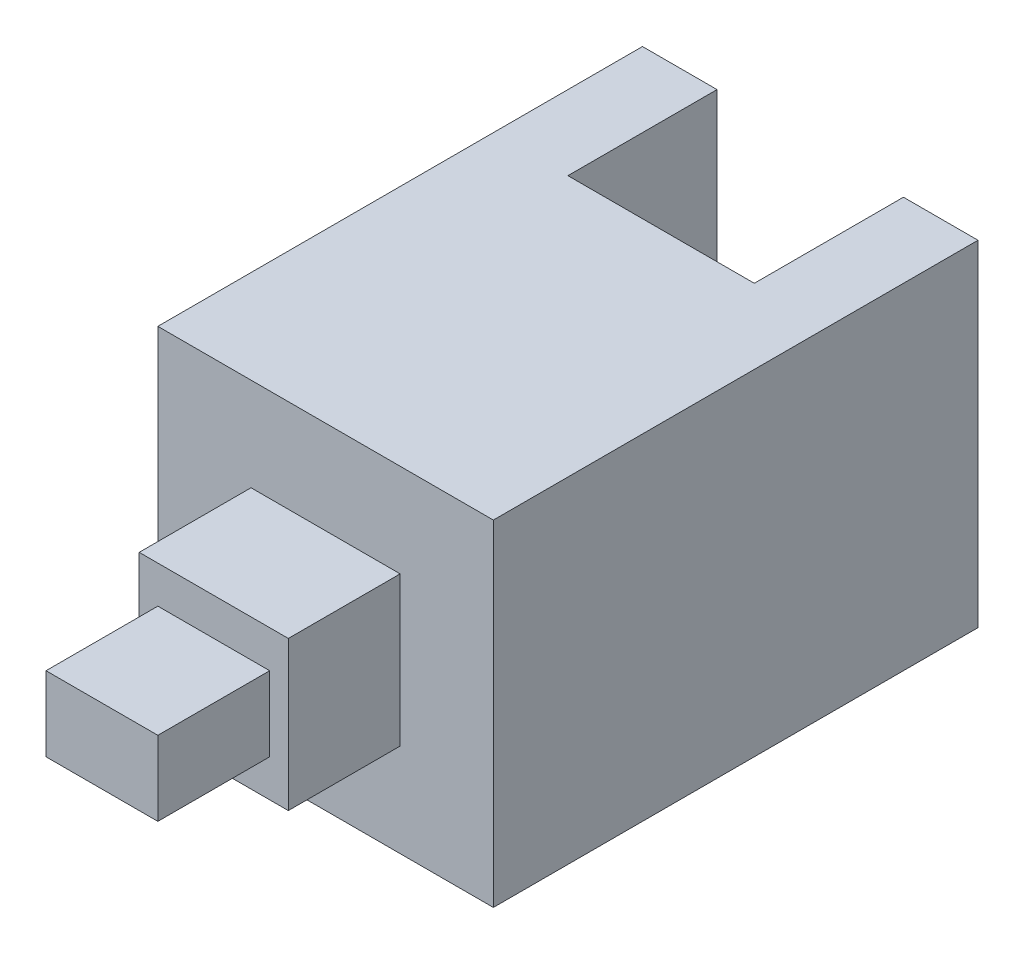
from build123d import *

# Parameters (mm, degrees)
SKETCH1_W           = 9
SKETCH1_H           = 9
MAIN_BODY_DEPTH     = 9
SKETCH2_W           = 4
SKETCH2_H           = 4
BOSS_EXTRUDE2_DEPTH = 3
SKETCH3_W           = 3
SKETCH3_H           = 2
BOSS_EXTRUDE3_DEPTH = 3
SKETCH4_W           = 2
SKETCH4_H           = 9
PINS_DEPTH          = 4


with BuildPart() as part:
    # Sketch1 → MAIN BODY (new body)
    with BuildSketch(Plane.XY):
        Rectangle(SKETCH1_W, SKETCH1_H)
    extrude(amount=MAIN_BODY_DEPTH)

    # Sketch2 → Boss-Extrude2 (add)
    with BuildSketch(Plane.XY.offset(9)):
        Rectangle(SKETCH2_W, SKETCH2_H)
    extrude(amount=BOSS_EXTRUDE2_DEPTH)

    # Sketch3 → Boss-Extrude3 (add)
    with BuildSketch(Plane.XY.offset(12)):
        Rectangle(SKETCH3_W, SKETCH3_H)
    extrude(amount=BOSS_EXTRUDE3_DEPTH)

    # Sketch4 → PINS (add)
    with BuildSketch(Plane(origin=(0, 0, 0), x_dir=(-1, 0, 0), z_dir=(0, 0, -1))):
        with Locations((-3.5, 0)):
            Rectangle(SKETCH4_W, SKETCH4_H)
        with Locations((3.5, 0)):
            Rectangle(SKETCH4_W, SKETCH4_H)
    extrude(amount=PINS_DEPTH)


solid = part.part
